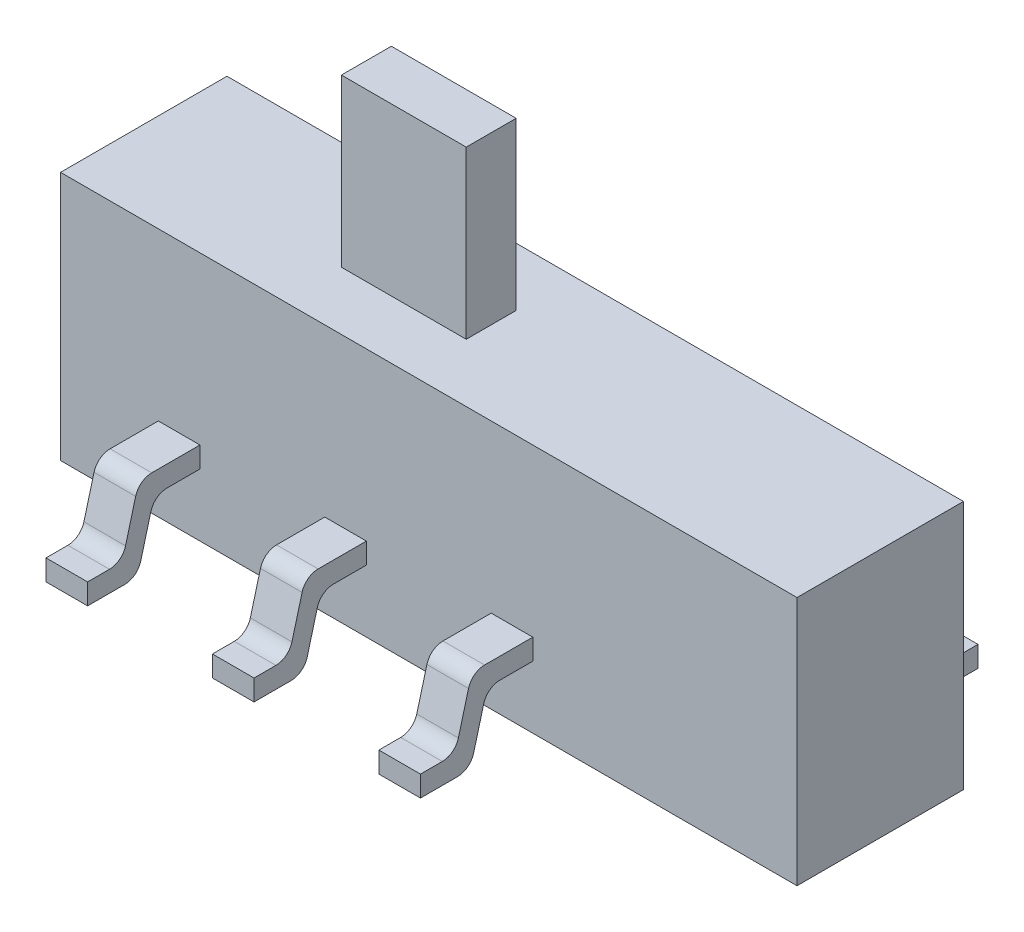
from build123d import *

# Parameters (mm, degrees)
SKETCH1_W         = 8.85
SKETCH1_H         = 2
BODY_DEPTH        = 3
SKETCH2_W         = 1.5
SKETCH2_H         = 0.6
SWITCH_DEPTH      = 2
PIN_B_DEPTH       = 0.25
LPATTERN1_COUNT   = 2
LPATTERN1_PITCH   = 2
LPATTERN1_2_COUNT = 2
LPATTERN1_2_PITCH = 2
LPATTERN2_COUNT   = 2
LPATTERN2_PITCH   = 6


with BuildPart() as part:
    # Sketch1 → Body (new body)
    with BuildSketch(Plane(origin=(0, 0, 0), x_dir=(1, 0, 0), z_dir=(0, 1, 0))):
        Rectangle(SKETCH1_W, SKETCH1_H)
    extrude(amount=BODY_DEPTH)


with BuildPart() as body_2:
    # Sketch2 → Switch (new body)
    with BuildSketch(Plane(origin=(0, 3, 0), x_dir=(1, 0, 0), z_dir=(0, 1, 0))):
        with Locations((-1, 0)):
            Rectangle(SKETCH2_W, SKETCH2_H)
    extrude(amount=SWITCH_DEPTH)


with BuildPart() as body_3:
    # Sketch3 → Pin B (new, symmetric)
    with BuildSketch(Plane(origin=(-1, 0, 0), x_dir=(0, 0, -1), z_dir=(1, 0, 0))):
        with BuildLine():
            Line((-2.35, 0), (-1.904427292, 0))
            ThreePointArc((-1.904427292, 0), (-1.782675006, 0.041329332), (-1.711242127, 0.148236191))
            Line((-1.711242127, 0.148236191), (-1.589719768, 0.601763809))
            ThreePointArc((-1.589719768, 0.601763809), (-1.518286888, 0.708670668), (-1.396534602, 0.75))
            Line((-1.396534602, 0.75), (-1, 0.75))
            Line((-1, 0.75), (-1, 1))
            Line((-1, 1), (-1.579547304, 1))
            ThreePointArc((-1.579547304, 1), (-1.70129959, 0.958670668), (-1.77273247, 0.851763809))
            Line((-1.77273247, 0.851763809), (-1.894254829, 0.398236191))
            ThreePointArc((-1.894254829, 0.398236191), (-1.965687708, 0.291329332), (-2.087439994, 0.25))
            Line((-2.087439994, 0.25), (-2.35, 0.25))
            Line((-2.35, 0.25), (-2.35, 0))
        make_face()
    extrude(amount=PIN_B_DEPTH, both=True)


with BuildPart() as lpattern1_1:
    # LPattern1: pattern copy
    add(body_3.part.moved(Location(Vector(1, 0, 0) * (1 * LPATTERN1_PITCH))))


with BuildPart() as lpattern1_2_1:
    # LPattern1 2: pattern copy
    add(body_3.part.moved(Location(Vector(-1, 0, 0) * (1 * LPATTERN1_2_PITCH))))


with BuildPart() as body_6:
    # Mirror1: mirrored copy
    add(lpattern1_2_1.part.mirror(Plane.XY))


with BuildPart() as lpattern2_1:
    # LPattern2: pattern copy
    add(body_6.part.moved(Location(Vector(1, 0, 0) * (1 * LPATTERN2_PITCH))))


solid = Compound([part.part, body_2.part, body_3.part, lpattern1_1.part, lpattern1_2_1.part, body_6.part, lpattern2_1.part])
